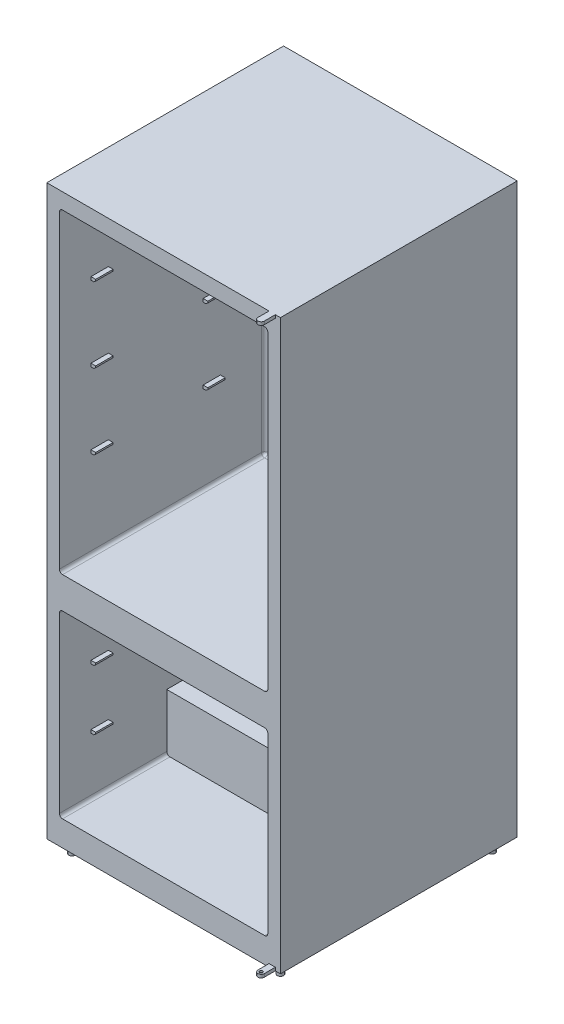
from build123d import *
from OCP.BRepFilletAPI import BRepFilletAPI_MakeChamfer

# Parameters (mm, degrees)
ESBO_O1_W                = 740
ESBO_O1_H                = 750
RESSALTO_EXTRUS_O1_DEPTH = 1800
ESBO_O5_W                = 660
ESBO_O5_H                = 1000
ESBO_O5_H_2              = 570
CORTE_EXTRUS_O1_DEPTH    = 650
FILETE1_R                = 10
ESBO_O7_R                = 10
RESSALTO_EXTRUS_O3_DEPTH = 40
ESBO_O10_W               = 55
ESBO_O10_H               = 10
RESSALTO_EXTRUS_O4_DEPTH = 15
ESBO_O14_W               = 55
ESBO_O14_H               = 10
RESSALTO_EXTRUS_O5_DEPTH = 15
CHANFRO1_SIZE            = 5
CHANFRO1_SIZE2           = 5.958767963
RESSALTO_EXTRUS_O6_DEPTH = 10
ESBO_O18_R               = 5
CORTE_EXTRUS_O2_DEPTH    = 5
ESBO_O19_W               = 720
ESBO_O19_H               = 240
CORTE_EXTRUS_O5_DEPTH    = 400
RESSALTO_EXTRUS_O8_REACH = 2073.835


with BuildPart() as part:
    # Esboço1 → Ressalto-extrusão1 (new body)
    with BuildSketch(Plane(origin=(0, 0, 0), x_dir=(1, 0, 0), z_dir=(0, 1, 0))):
        with Locations((370, 375)):
            Rectangle(ESBO_O1_W, ESBO_O1_H)
    extrude(amount=RESSALTO_EXTRUS_O1_DEPTH)

    # Esboço5 → Corte-extrusão1 (cut)
    with BuildSketch(Plane.XY):
        with Locations((370, 1250)):
            Rectangle(ESBO_O5_W, ESBO_O5_H)
        with Locations((370, 365)):
            Rectangle(ESBO_O5_W, ESBO_O5_H_2)
    extrude(amount=-CORTE_EXTRUS_O1_DEPTH, mode=Mode.SUBTRACT)

    # Filete1
    filete1_edges = [part.edges().sort_by_distance(p)[0] for p in [
        (40, 1250, -650),
        (40, 750, -325),
        (370, 1750, -650),
        (40, 1750, -325),
        (700, 1250, -650),
        (700, 1750, -325),
        (370, 750, -650),
        (700, 750, -325),
        (40, 365, -650),
        (40, 80, -325),
        (370, 650, -650),
        (40, 650, -325),
        (700, 365, -650),
        (700, 650, -325),
        (370, 80, -650),
        (700, 80, -325),
    ]]
    fillet(filete1_edges, radius=FILETE1_R)

    # Esboço7 → Ressalto-extrusão3 (add)
    with BuildSketch(Plane.XZ):
        with Locations(Location((40, -40, 0), (0, 0, 270))):
            Circle(ESBO_O7_R)
        with Locations(Location((700, -40, 0), (0, 0, 270))):
            Circle(ESBO_O7_R)
        with Locations(Location((700, -710, 0), (0, 0, 270))):
            Circle(ESBO_O7_R)
        with Locations(Location((40, -710, 0), (0, 0, 270))):
            Circle(ESBO_O7_R)
    extrude(amount=RESSALTO_EXTRUS_O3_DEPTH)

    # Esboço10 → Ressalto-extrusão4 (add)
    with BuildSketch(Plane(origin=(40, 0, 0), x_dir=(0, 0, -1), z_dir=(1, 0, 0))):
        with Locations((127.5, 1507.5)):
            Rectangle(ESBO_O10_W, ESBO_O10_H)
        with Locations((482.5, 1507.5)):
            Rectangle(ESBO_O10_W, ESBO_O10_H)
        with Locations((482.5, 1270)):
            Rectangle(ESBO_O10_W, ESBO_O10_H)
        with Locations((482.5, 1032.5)):
            Rectangle(ESBO_O10_W, ESBO_O10_H)
        with Locations((127.5, 1270)):
            Rectangle(ESBO_O10_W, ESBO_O10_H)
        with Locations((127.5, 1032.5)):
            Rectangle(ESBO_O10_W, ESBO_O10_H)
    ressalto_extrus_o4 = extrude(amount=RESSALTO_EXTRUS_O4_DEPTH)

    # Espelhar4: Ressalto-extrusão4 across plane
    add(ressalto_extrus_o4.mirror(Plane(origin=(370, 0, 0), x_dir=(0, 0, 1), z_dir=(1, 0, 0))))

    # Esboço14 → Ressalto-extrusão5 (add)
    with BuildSketch(Plane(origin=(40, 0, 0), x_dir=(0, 0, -1), z_dir=(1, 0, 0))):
        with Locations((127.5, 455)):
            Rectangle(ESBO_O14_W, ESBO_O14_H)
        with Locations((482.5, 455)):
            Rectangle(ESBO_O14_W, ESBO_O14_H)
        with Locations((482.5, 265)):
            Rectangle(ESBO_O14_W, ESBO_O14_H)
        with Locations((127.5, 265)):
            Rectangle(ESBO_O14_W, ESBO_O14_H)
    ressalto_extrus_o5 = extrude(amount=RESSALTO_EXTRUS_O5_DEPTH)

    # Espelhar5: Ressalto-extrusão5 across plane
    add(ressalto_extrus_o5.mirror(Plane(origin=(370, 0, 0), x_dir=(0, 0, 1), z_dir=(1, 0, 0))))

    # Chanfro1: one chamfer whose edges measure the first distance from different faces: ONE call of the kernel's chamfer builder (chamfer() names one face for all edges)
    chanfro1_edges_1 = [part.edges().sort_by_distance(p)[0] for p in [
        (55, 1502.5, -127.5),
    ]]
    chanfro1_side_1 = [part.faces().sort_by_distance(p)[0] for p in [
        (55, 1507.5, -127.5),
    ]]
    chanfro1_edges_2 = [part.edges().sort_by_distance(p)[0] for p in [
        (55, 1502.5, -482.5),
    ]]
    chanfro1_side_2 = [part.faces().sort_by_distance(p)[0] for p in [
        (55, 1507.5, -482.5),
    ]]
    chanfro1_edges_3 = [part.edges().sort_by_distance(p)[0] for p in [
        (55, 1265, -482.5),
    ]]
    chanfro1_side_3 = [part.faces().sort_by_distance(p)[0] for p in [
        (55, 1270, -482.5),
    ]]
    chanfro1_edges_4 = [part.edges().sort_by_distance(p)[0] for p in [
        (55, 1027.5, -482.5),
    ]]
    chanfro1_side_4 = [part.faces().sort_by_distance(p)[0] for p in [
        (55, 1032.5, -482.5),
    ]]
    chanfro1_edges_5 = [part.edges().sort_by_distance(p)[0] for p in [
        (55, 1265, -127.5),
    ]]
    chanfro1_side_5 = [part.faces().sort_by_distance(p)[0] for p in [
        (55, 1270, -127.5),
    ]]
    chanfro1_edges_6 = [part.edges().sort_by_distance(p)[0] for p in [
        (55, 1027.5, -127.5),
    ]]
    chanfro1_side_6 = [part.faces().sort_by_distance(p)[0] for p in [
        (55, 1032.5, -127.5),
    ]]
    chanfro1_edges_7 = [part.edges().sort_by_distance(p)[0] for p in [
        (685, 1502.5, -127.5),
    ]]
    chanfro1_side_7 = [part.faces().sort_by_distance(p)[0] for p in [
        (692.5, 1502.5, -127.5),
    ]]
    chanfro1_edges_8 = [part.edges().sort_by_distance(p)[0] for p in [
        (685, 1502.5, -482.5),
    ]]
    chanfro1_side_8 = [part.faces().sort_by_distance(p)[0] for p in [
        (692.5, 1502.5, -482.5),
    ]]
    chanfro1_edges_9 = [part.edges().sort_by_distance(p)[0] for p in [
        (685, 1265, -482.5),
    ]]
    chanfro1_side_9 = [part.faces().sort_by_distance(p)[0] for p in [
        (692.5, 1265, -482.5),
    ]]
    chanfro1_edges_10 = [part.edges().sort_by_distance(p)[0] for p in [
        (685, 1027.5, -482.5),
    ]]
    chanfro1_side_10 = [part.faces().sort_by_distance(p)[0] for p in [
        (692.5, 1027.5, -482.5),
    ]]
    chanfro1_edges_11 = [part.edges().sort_by_distance(p)[0] for p in [
        (685, 1265, -127.5),
    ]]
    chanfro1_side_11 = [part.faces().sort_by_distance(p)[0] for p in [
        (692.5, 1265, -127.5),
    ]]
    chanfro1_edges_12 = [part.edges().sort_by_distance(p)[0] for p in [
        (685, 1027.5, -127.5),
    ]]
    chanfro1_side_12 = [part.faces().sort_by_distance(p)[0] for p in [
        (692.5, 1027.5, -127.5),
    ]]
    chanfro1_edges_13 = [part.edges().sort_by_distance(p)[0] for p in [
        (55, 450, -127.5),
    ]]
    chanfro1_side_13 = [part.faces().sort_by_distance(p)[0] for p in [
        (55, 455, -127.5),
    ]]
    chanfro1_edges_14 = [part.edges().sort_by_distance(p)[0] for p in [
        (55, 450, -482.5),
    ]]
    chanfro1_side_14 = [part.faces().sort_by_distance(p)[0] for p in [
        (55, 455, -482.5),
    ]]
    chanfro1_edges_15 = [part.edges().sort_by_distance(p)[0] for p in [
        (55, 260, -482.5),
    ]]
    chanfro1_side_15 = [part.faces().sort_by_distance(p)[0] for p in [
        (55, 265, -482.5),
    ]]
    chanfro1_edges_16 = [part.edges().sort_by_distance(p)[0] for p in [
        (55, 260, -127.5),
    ]]
    chanfro1_side_16 = [part.faces().sort_by_distance(p)[0] for p in [
        (55, 265, -127.5),
    ]]
    chanfro1_edges_17 = [part.edges().sort_by_distance(p)[0] for p in [
        (685, 450, -127.5),
    ]]
    chanfro1_side_17 = [part.faces().sort_by_distance(p)[0] for p in [
        (692.5, 450, -127.5),
    ]]
    chanfro1_edges_18 = [part.edges().sort_by_distance(p)[0] for p in [
        (685, 450, -482.5),
    ]]
    chanfro1_side_18 = [part.faces().sort_by_distance(p)[0] for p in [
        (692.5, 450, -482.5),
    ]]
    chanfro1_edges_19 = [part.edges().sort_by_distance(p)[0] for p in [
        (685, 260, -482.5),
    ]]
    chanfro1_side_19 = [part.faces().sort_by_distance(p)[0] for p in [
        (692.5, 260, -482.5),
    ]]
    chanfro1_edges_20 = [part.edges().sort_by_distance(p)[0] for p in [
        (685, 260, -127.5),
    ]]
    chanfro1_side_20 = [part.faces().sort_by_distance(p)[0] for p in [
        (692.5, 260, -127.5),
    ]]
    chanfro1 = BRepFilletAPI_MakeChamfer(part.part.solid().wrapped)
    for e in chanfro1_edges_1:
        chanfro1.Add(CHANFRO1_SIZE, CHANFRO1_SIZE2, e.wrapped, chanfro1_side_1[0].wrapped)  # the first distance lies on this face
    for e in chanfro1_edges_2:
        chanfro1.Add(CHANFRO1_SIZE, CHANFRO1_SIZE2, e.wrapped, chanfro1_side_2[0].wrapped)  # the first distance lies on this face
    for e in chanfro1_edges_3:
        chanfro1.Add(CHANFRO1_SIZE, CHANFRO1_SIZE2, e.wrapped, chanfro1_side_3[0].wrapped)  # the first distance lies on this face
    for e in chanfro1_edges_4:
        chanfro1.Add(CHANFRO1_SIZE, CHANFRO1_SIZE2, e.wrapped, chanfro1_side_4[0].wrapped)  # the first distance lies on this face
    for e in chanfro1_edges_5:
        chanfro1.Add(CHANFRO1_SIZE, CHANFRO1_SIZE2, e.wrapped, chanfro1_side_5[0].wrapped)  # the first distance lies on this face
    for e in chanfro1_edges_6:
        chanfro1.Add(CHANFRO1_SIZE, CHANFRO1_SIZE2, e.wrapped, chanfro1_side_6[0].wrapped)  # the first distance lies on this face
    for e in chanfro1_edges_7:
        chanfro1.Add(CHANFRO1_SIZE, CHANFRO1_SIZE2, e.wrapped, chanfro1_side_7[0].wrapped)  # the first distance lies on this face
    for e in chanfro1_edges_8:
        chanfro1.Add(CHANFRO1_SIZE, CHANFRO1_SIZE2, e.wrapped, chanfro1_side_8[0].wrapped)  # the first distance lies on this face
    for e in chanfro1_edges_9:
        chanfro1.Add(CHANFRO1_SIZE, CHANFRO1_SIZE2, e.wrapped, chanfro1_side_9[0].wrapped)  # the first distance lies on this face
    for e in chanfro1_edges_10:
        chanfro1.Add(CHANFRO1_SIZE, CHANFRO1_SIZE2, e.wrapped, chanfro1_side_10[0].wrapped)  # the first distance lies on this face
    for e in chanfro1_edges_11:
        chanfro1.Add(CHANFRO1_SIZE, CHANFRO1_SIZE2, e.wrapped, chanfro1_side_11[0].wrapped)  # the first distance lies on this face
    for e in chanfro1_edges_12:
        chanfro1.Add(CHANFRO1_SIZE, CHANFRO1_SIZE2, e.wrapped, chanfro1_side_12[0].wrapped)  # the first distance lies on this face
    for e in chanfro1_edges_13:
        chanfro1.Add(CHANFRO1_SIZE, CHANFRO1_SIZE2, e.wrapped, chanfro1_side_13[0].wrapped)  # the first distance lies on this face
    for e in chanfro1_edges_14:
        chanfro1.Add(CHANFRO1_SIZE, CHANFRO1_SIZE2, e.wrapped, chanfro1_side_14[0].wrapped)  # the first distance lies on this face
    for e in chanfro1_edges_15:
        chanfro1.Add(CHANFRO1_SIZE, CHANFRO1_SIZE2, e.wrapped, chanfro1_side_15[0].wrapped)  # the first distance lies on this face
    for e in chanfro1_edges_16:
        chanfro1.Add(CHANFRO1_SIZE, CHANFRO1_SIZE2, e.wrapped, chanfro1_side_16[0].wrapped)  # the first distance lies on this face
    for e in chanfro1_edges_17:
        chanfro1.Add(CHANFRO1_SIZE, CHANFRO1_SIZE2, e.wrapped, chanfro1_side_17[0].wrapped)  # the first distance lies on this face
    for e in chanfro1_edges_18:
        chanfro1.Add(CHANFRO1_SIZE, CHANFRO1_SIZE2, e.wrapped, chanfro1_side_18[0].wrapped)  # the first distance lies on this face
    for e in chanfro1_edges_19:
        chanfro1.Add(CHANFRO1_SIZE, CHANFRO1_SIZE2, e.wrapped, chanfro1_side_19[0].wrapped)  # the first distance lies on this face
    for e in chanfro1_edges_20:
        chanfro1.Add(CHANFRO1_SIZE, CHANFRO1_SIZE2, e.wrapped, chanfro1_side_20[0].wrapped)  # the first distance lies on this face
    add(Compound.cast(chanfro1.Shape()), mode=Mode.REPLACE)

    # Esboço17 → Ressalto-extrusão6 (add)
    with BuildSketch(Plane(origin=(0, 1800, 0), x_dir=(1, 0, 0), z_dir=(0, 1, 0))):
        with BuildLine():
            Line((703.893019461, 0), (723.893019461, 0))
            Line((723.893019461, 0), (723.893019461, -35))
            ThreePointArc((723.893019461, -35), (713.893019461, -45), (703.893019461, -35))
            Line((703.893019461, -35), (703.893019461, 0))
        make_face()
    ressalto_extrus_o6 = extrude(amount=-RESSALTO_EXTRUS_O6_DEPTH)

    # Esboço18 → Corte-extrusão2 (cut)
    with BuildSketch(Plane.XZ.offset(-1790)):
        with Locations(Location((713.893019461, 35, 0), (0, 0, 270))):
            Circle(ESBO_O18_R)
    corte_extrus_o2 = extrude(amount=-CORTE_EXTRUS_O2_DEPTH, mode=Mode.SUBTRACT)

    # Espelhar6: Ressalto-extrusão6, Corte-extrusão2 across plane
    add(ressalto_extrus_o6.mirror(Plane.ZX.offset(900)))
    add(corte_extrus_o2.mirror(Plane.ZX.offset(900)), mode=Mode.SUBTRACT)

    # Esboço19 → Corte-extrusão5 (cut)
    with BuildSketch(Plane(origin=(0, 0, -750), x_dir=(-1, 0, 0), z_dir=(0, 0, -1))):
        with Locations((-370, 130)):
            Rectangle(ESBO_O19_W, ESBO_O19_H)
    extrude(amount=-CORTE_EXTRUS_O5_DEPTH, mode=Mode.SUBTRACT)

    # Esboço21 → Ressalto-extrusão8 (add, up to next)
    with BuildSketch(Plane.ZY.offset(-700), mode=Mode.PRIVATE) as ressalto_extrus_o8_sk1:
        Polygon((-640, 250), (-350, 250), (-350, 0), (-340, 0), (-340, 260), (-640, 260), align=None)
    ressalto_extrus_o8_tool1 = extrude(ressalto_extrus_o8_sk1.sketch, amount=RESSALTO_EXTRUS_O8_REACH, mode=Mode.PRIVATE) - part.part
    add(ressalto_extrus_o8_tool1.solids().sort_by_distance((700, 253.969887, -495))[0])


solid = part.part
